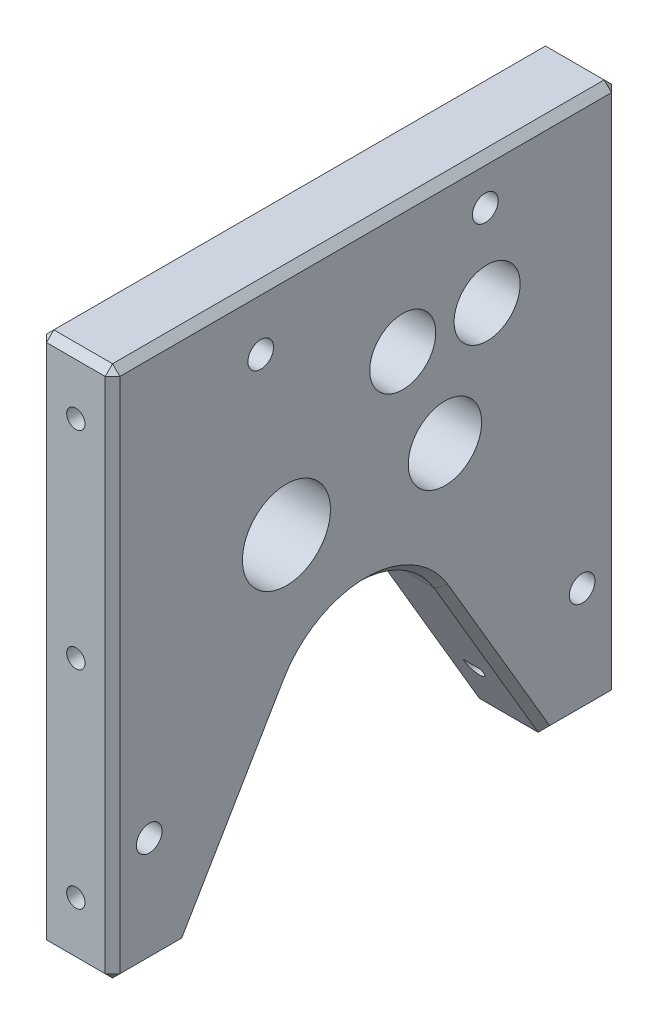
from build123d import *

# Parameters (mm, degrees)
SKETCH4_R           = 1.75
SKETCH4_R_2         = 4.500000047
SKETCH4_R_3         = 5
SKETCH4_R_4         = 6
BOSS_EXTRUDE2_DEPTH = 10
SKETCH5_R           = 1.25
CUT_EXTRUDE2_DEPTH  = 15
CHAMFER1_SIZE       = 1


with BuildPart() as part:
    # Sketch4 → Boss-Extrude2 (new body)
    with BuildSketch(Plane(origin=(0, 0, 0), x_dir=(0, 0, -1), z_dir=(1, 0, 0))):
        with BuildLine():
            Line((-162.000000477, 67.500002682), (-231, 67.500002682))
            Line((-231, 67.500002682), (-231, -4.999999888))
            Line((-231, -4.999999888), (-220.999994636, -4.999999888))
            Line((-220.999994636, -4.999999888), (-206.845160655, 19.080913937))
            ThreePointArc((-206.845160655, 19.080913937), (-196.500000238, 24.999992792), (-186.154839822, 19.080913937))
            Line((-186.154839822, 19.080913937), (-172.000005841, -4.999999888))
            Line((-172.000005841, -4.999999888), (-162.000000477, -4.999999888))
            Line((-162.000000477, -4.999999888), (-162.000000477, 67.500002682))
        make_face()
        with Locations((-167.000003631, 10.000003689)):
            Circle(SKETCH4_R, mode=Mode.SUBTRACT)
        with Locations((-179.950002543, 50.158835948)):
            Circle(SKETCH4_R_2, mode=Mode.SUBTRACT)
        with Locations((-185.699998003, 36.458836819)):
            Circle(SKETCH4_R_3, mode=Mode.SUBTRACT)
        with Locations((-180.200001261, 61.499996666)):
            Circle(SKETCH4_R, mode=Mode.SUBTRACT)
        with Locations((-191.4500039, 50.158835948)):
            Circle(SKETCH4_R_2, mode=Mode.SUBTRACT)
        with Locations((-207.29999885, 36.458836819)):
            Circle(SKETCH4_R_4, mode=Mode.SUBTRACT)
        with Locations((-210.799998228, 59.499998412)):
            Circle(SKETCH4_R, mode=Mode.SUBTRACT)
        with Locations((-226, 10.000003689)):
            Circle(SKETCH4_R, mode=Mode.SUBTRACT)
    extrude(amount=-BOSS_EXTRUDE2_DEPTH)

    # Sketch5 → Cut-Extrude2 (cut)
    with BuildSketch(Plane.XY.offset(231)):
        with Locations((-5, 59.500002682)):
            Circle(SKETCH5_R)
        with Locations((-5, 31.250001397)):
            Circle(SKETCH5_R)
        with Locations((-5, 3.000002682)):
            Circle(SKETCH5_R)
    cut_extrude2 = extrude(amount=-CUT_EXTRUDE2_DEPTH, mode=Mode.SUBTRACT)

    # Mirror1: Cut-Extrude2 across plane
    add(cut_extrude2.mirror(Plane.XY.offset(196.500000238)), mode=Mode.SUBTRACT)

    # Chamfer1
    chamfer1_edges = [part.edges().sort_by_distance(p)[0] for p in [
        (0, -4.999999888, 225.999997318),
        (0, 31.250001397, 231),
        (0, 67.500002682, 196.500000238),
        (0, 31.250001397, 162.000000477),
        (-10, 31.250001397, 231),
        (-5, -4.999999888, 162.000000477),
        (-5, -4.999999888, 231),
        (-5, 67.500002682, 231),
        (-5, 67.500002682, 162.000000477),
        (-10, -4.999999888, 225.999997318),
        (-10, 7.040457024, 213.922577645),
        (-10, 24.999992792, 196.500000238),
        (-10, 7.040457024, 179.077422832),
        (-10, -4.999999888, 167.000003159),
        (-10, 31.250001397, 162.000000477),
        (0, -4.999999888, 167.000003159),
        (-10, 67.500002682, 196.500000238),
        (0, 7.040457024, 179.077422832),
        (0, 24.999992792, 196.500000238),
        (0, 7.040457024, 213.922577645),
    ]]
    chamfer(chamfer1_edges, length=CHAMFER1_SIZE)


solid = part.part
